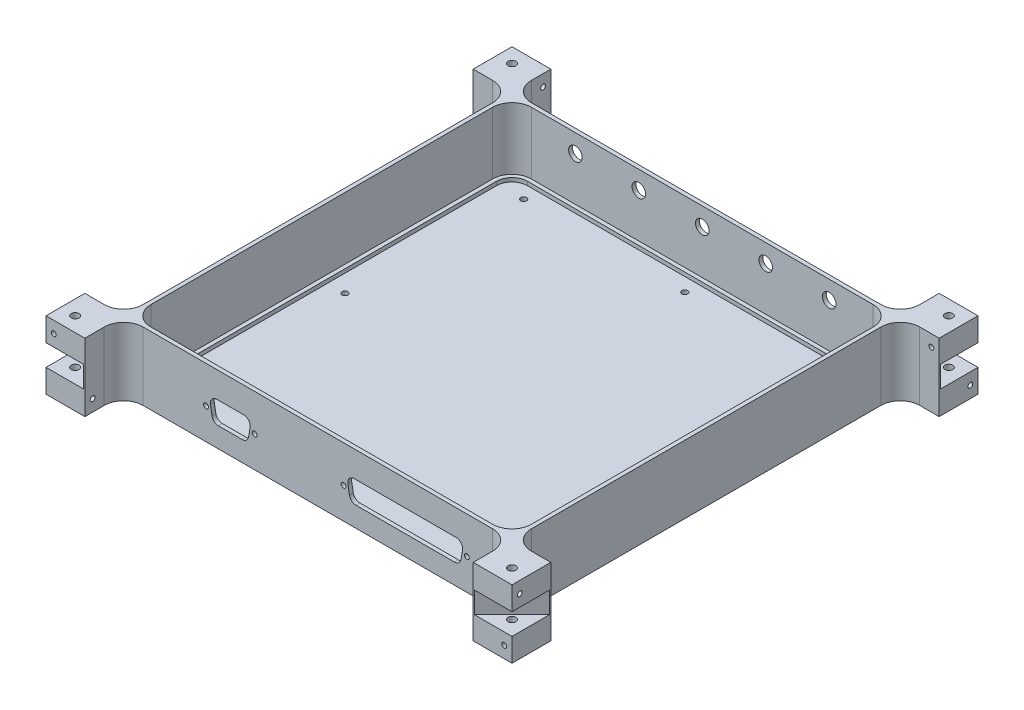
from build123d import *

# Parameters (mm, degrees)
BOSS_EXTRUDE1_DEPTH                   = 17.5
CUT_EXTRUDE1_DEPTH                    = 32
CUT_EXTRUDE2_DEPTH                    = 2
BOSS_EXTRUDE2_DEPTH                   = 2
CUT_EXTRUDE3_DEPTH                    = 11
CIRPATTERN1_COUNT                     = 4
SKETCH6_R                             = 2
CUT_EXTRUDE4_DEPTH                    = 174.692256592
CIRPATTERN2_COUNT                     = 4
TAP_DRILL_FOR_M3_TAP1_D               = 2.5
TAP_DRILL_FOR_M3_TAP1_DEPTH           = 20
TAP_DRILL_FOR_M3_TAP1_ON_FACE_2_D     = 2.5
TAP_DRILL_FOR_M3_TAP1_ON_FACE_2_DEPTH = 20
TAP_DRILL_FOR_M3_TAP1_ON_FACE_3_D     = 2.5
TAP_DRILL_FOR_M3_TAP1_ON_FACE_3_DEPTH = 20
TAP_DRILL_FOR_M3_TAP1_ON_FACE_4_D     = 2.5
TAP_DRILL_FOR_M3_TAP1_ON_FACE_4_DEPTH = 20
F_3_0_3_DIAMETER_HOLE1_D              = 3
F_3_0_3_DIAMETER_HOLE1_DEPTH          = 20
F_3_0_3_DIAMETER_HOLE1_TIP            = 0.901290929
CUT_EXTRUDE5_REACH                    = 253.357
SKETCH16_R                            = 3.5
CUT_EXTRUDE6_DEPTH                    = 10
M3X0_5_TAPPED_HOLE1_D                 = 2.5
M3X0_5_TAPPED_HOLE1_DEPTH             = 5
M3X0_5_TAPPED_HOLE1_TIP               = 0.751075774


with BuildPart() as part:
    # Sketch1 → Boss-Extrude1 (new, symmetric)
    with BuildSketch(Plane(origin=(0, 0, 0), x_dir=(1, 0, 0), z_dir=(0, 1, 0))):
        with BuildLine():
            ThreePointArc((-110, 100), (-102.928932188, 97.071067812), (-100, 90))
            Line((-100, 90), (-100, -90))
            ThreePointArc((-100, -90), (-102.928932188, -97.071067812), (-110, -100))
            Line((-110, -100), (-120, -100))
            Line((-120, -100), (-120, -120))
            Line((-120, -120), (-100, -120))
            Line((-100, -120), (-100, -110))
            ThreePointArc((-100, -110), (-97.071067812, -102.928932188), (-90, -100))
            Line((-90, -100), (90, -100))
            ThreePointArc((90, -100), (97.071067812, -102.928932188), (100, -110))
            Line((100, -110), (100, -120))
            Line((100, -120), (120, -120))
            Line((120, -120), (120, -100))
            Line((120, -100), (110, -100))
            ThreePointArc((110, -100), (102.928932188, -97.071067812), (100, -90))
            Line((100, -90), (100, 90))
            ThreePointArc((100, 90), (102.928932188, 97.071067812), (110, 100))
            Line((110, 100), (120, 100))
            Line((120, 100), (120, 120))
            Line((120, 120), (100, 120))
            Line((100, 120), (100, 110))
            ThreePointArc((100, 110), (97.071067812, 102.928932188), (90, 100))
            Line((90, 100), (-90, 100))
            ThreePointArc((-90, 100), (-97.071067812, 102.928932188), (-100, 110))
            Line((-100, 110), (-100, 120))
            Line((-100, 120), (-120, 120))
            Line((-120, 120), (-120, 100))
            Line((-120, 100), (-110, 100))
        make_face()
    extrude(amount=BOSS_EXTRUDE1_DEPTH, both=True)

    # Sketch2 → Cut-Extrude1 (cut)
    with BuildSketch(Plane(origin=(0, 17.5, 0), x_dir=(1, 0, 0), z_dir=(0, 1, 0))):
        with BuildLine():
            Line((-88, 98), (88, 98))
            ThreePointArc((88, 98), (95.071067812, 95.071067812), (98, 88))
            Line((98, 88), (98, -88))
            ThreePointArc((98, -88), (95.071067812, -95.071067812), (88, -98))
            Line((88, -98), (-88, -98))
            ThreePointArc((-88, -98), (-95.071067812, -95.071067812), (-98, -88))
            Line((-98, -88), (-98, 88))
            ThreePointArc((-98, 88), (-95.071067812, 95.071067812), (-88, 98))
        make_face()
    extrude(amount=-CUT_EXTRUDE1_DEPTH, mode=Mode.SUBTRACT)

    # Sketch3 → Cut-Extrude2 (cut)
    with BuildSketch(Plane(origin=(0, -14.5, 0), x_dir=(1, 0, 0), z_dir=(0, 1, 0))):
        with BuildLine():
            Line((-88, -96), (88, -96))
            ThreePointArc((88, -96), (93.656854249, -93.656854249), (96, -88))
            Line((96, -88), (96, 88))
            ThreePointArc((96, 88), (93.656854249, 93.656854249), (88, 96))
            Line((88, 96), (-88, 96))
            ThreePointArc((-88, 96), (-93.656854249, 93.656854249), (-96, 88))
            Line((-96, 88), (-96, -88))
            ThreePointArc((-96, -88), (-93.656854249, -93.656854249), (-88, -96))
        make_face()
    extrude(amount=-CUT_EXTRUDE2_DEPTH, mode=Mode.SUBTRACT)

    # Sketch4 → Boss-Extrude2 (add)
    with BuildSketch(Plane.XZ.offset(17.5)):
        with BuildLine():
            Line((-88, -98), (88, -98))
            ThreePointArc((88, -98), (95.071067812, -95.071067812), (98, -88))
            Line((98, -88), (98, 88))
            ThreePointArc((98, 88), (95.071067812, 95.071067812), (88, 98))
            Line((88, 98), (-88, 98))
            ThreePointArc((-88, 98), (-95.071067812, 95.071067812), (-98, 88))
            Line((-98, 88), (-98, -88))
            ThreePointArc((-98, -88), (-95.071067812, -95.071067812), (-88, -98))
        make_face()
    extrude(amount=BOSS_EXTRUDE2_DEPTH)

    # Sketch5 → Cut-Extrude3 (cut)
    with BuildSketch(Plane(origin=(0, -5.5, 0), x_dir=(1, 0, 0), z_dir=(0, 1, 0))):
        Polygon((-120, 100.61731573), (-100.61731573, 120), (-120, 120), align=None)
    cut_extrude3 = extrude(amount=CUT_EXTRUDE3_DEPTH, mode=Mode.SUBTRACT)

    # CirPattern1: Cut-Extrude3 ×4 about axis
    cirpattern1_axis = Axis((0, 0, 0), (0, 1, 0))
    for i in range(1, CIRPATTERN1_COUNT):
        add(cut_extrude3.rotate(cirpattern1_axis, i * 360 / CIRPATTERN1_COUNT), mode=Mode.SUBTRACT)

    # Sketch6 → Cut-Extrude4 (cut, through all)
    with BuildSketch(Plane(origin=(0, 17.5, 0), x_dir=(1, 0, 0), z_dir=(0, 1, 0))):
        with Locations(Location((-112.493820949, 112.493820949, 0), (0, 0, 270))):
            Circle(SKETCH6_R)
    cut_extrude4 = extrude(amount=-CUT_EXTRUDE4_DEPTH, mode=Mode.SUBTRACT)

    # CirPattern2: Cut-Extrude4 ×4 about axis
    cirpattern2_axis = Axis((0, 0, 0), (0, 1, 0))
    for i in range(1, CIRPATTERN2_COUNT):
        add(cut_extrude4.rotate(cirpattern2_axis, i * 360 / CIRPATTERN2_COUNT), mode=Mode.SUBTRACT)

    # Tap Drill for M3 Tap1
    with Locations(Plane(origin=(116, 11.5, -120), x_dir=(-1, 0, 0), z_dir=(0, 0, -1))):
        with Locations((0, 0), (232, -23)):
            Hole(TAP_DRILL_FOR_M3_TAP1_D / 2, depth=TAP_DRILL_FOR_M3_TAP1_DEPTH)

    # Tap Drill for M3 Tap1 on face 2
    with Locations(Plane(origin=(-120, 11.5, -116), x_dir=(0, 0, -1), z_dir=(-1, 0, 0))):
        with Locations((0, 0), (-232, 23)):
            Hole(TAP_DRILL_FOR_M3_TAP1_ON_FACE_2_D / 2, depth=TAP_DRILL_FOR_M3_TAP1_ON_FACE_2_DEPTH)

    # Tap Drill for M3 Tap1 on face 3
    with Locations(Plane(origin=(-116, 11.5, 120), x_dir=(1, 0, 0), z_dir=(0, 0, 1))):
        with Locations((0, 0), (232, -23)):
            Hole(TAP_DRILL_FOR_M3_TAP1_ON_FACE_3_D / 2, depth=TAP_DRILL_FOR_M3_TAP1_ON_FACE_3_DEPTH)

    # Tap Drill for M3 Tap1 on face 4
    with Locations(Plane(origin=(120, 11.5, 116), x_dir=(0, 0, 1), z_dir=(1, 0, 0))):
        with Locations((0, 0), (-232, 23)):
            Hole(TAP_DRILL_FOR_M3_TAP1_ON_FACE_4_D / 2, depth=TAP_DRILL_FOR_M3_TAP1_ON_FACE_4_DEPTH)

    # Ø3.0 (3) Diameter Hole1
    with Locations(Plane(origin=(0, 0, 0), x_dir=(1, 0, 0), z_dir=(0, 1, 0))):
        with Locations((-83, 89), (0, 89), (83, 89), (87, 1), (-87, 1), (-87, -87), (0, -87), (87, -87)):
            Hole(F_3_0_3_DIAMETER_HOLE1_D / 2, depth=F_3_0_3_DIAMETER_HOLE1_DEPTH)
            with Locations((0, 0, -(F_3_0_3_DIAMETER_HOLE1_DEPTH + F_3_0_3_DIAMETER_HOLE1_TIP / 2))):  # 118° drill point
                Cone(0, F_3_0_3_DIAMETER_HOLE1_D / 2, F_3_0_3_DIAMETER_HOLE1_TIP, mode=Mode.SUBTRACT)

    # Sketch16 → Cut-Extrude5 (cut, up to next)
    with BuildSketch(Plane(origin=(0, 0, -100), x_dir=(-1, 0, 0), z_dir=(0, 0, -1)), mode=Mode.PRIVATE) as cut_extrude5_sk1:
        with Locations((0, 8.1)):
            Circle(SKETCH16_R)
    cut_extrude5_tool1 = extrude(cut_extrude5_sk1.sketch, amount=-CUT_EXTRUDE5_REACH, mode=Mode.PRIVATE) & part.part
    # Sketch16 → Cut-Extrude5 (cut, up to next)
    with BuildSketch(Plane(origin=(0, 0, -100), x_dir=(-1, 0, 0), z_dir=(0, 0, -1)), mode=Mode.PRIVATE) as cut_extrude5_sk2:
        with Locations((32.67, 8.1)):
            Circle(SKETCH16_R)
    cut_extrude5_tool2 = extrude(cut_extrude5_sk2.sketch, amount=-CUT_EXTRUDE5_REACH, mode=Mode.PRIVATE) & part.part
    # Sketch16 → Cut-Extrude5 (cut, up to next)
    with BuildSketch(Plane(origin=(0, 0, -100), x_dir=(-1, 0, 0), z_dir=(0, 0, -1)), mode=Mode.PRIVATE) as cut_extrude5_sk3:
        with Locations((65.34, 8.1)):
            Circle(SKETCH16_R)
    cut_extrude5_tool3 = extrude(cut_extrude5_sk3.sketch, amount=-CUT_EXTRUDE5_REACH, mode=Mode.PRIVATE) & part.part
    # Sketch16 → Cut-Extrude5 (cut, up to next)
    with BuildSketch(Plane(origin=(0, 0, -100), x_dir=(-1, 0, 0), z_dir=(0, 0, -1)), mode=Mode.PRIVATE) as cut_extrude5_sk4:
        with Locations((-32.67, 8.1)):
            Circle(SKETCH16_R)
    cut_extrude5_tool4 = extrude(cut_extrude5_sk4.sketch, amount=-CUT_EXTRUDE5_REACH, mode=Mode.PRIVATE) & part.part
    # Sketch16 → Cut-Extrude5 (cut, up to next)
    with BuildSketch(Plane(origin=(0, 0, -100), x_dir=(-1, 0, 0), z_dir=(0, 0, -1)), mode=Mode.PRIVATE) as cut_extrude5_sk5:
        with Locations((-65.34, 8.1)):
            Circle(SKETCH16_R)
    cut_extrude5_tool5 = extrude(cut_extrude5_sk5.sketch, amount=-CUT_EXTRUDE5_REACH, mode=Mode.PRIVATE) & part.part
    add(cut_extrude5_tool1.solids().sort_by_distance((0, 8.1, -100))[0], mode=Mode.SUBTRACT)
    add(cut_extrude5_tool2.solids().sort_by_distance((-32.67, 8.1, -100))[0], mode=Mode.SUBTRACT)
    add(cut_extrude5_tool3.solids().sort_by_distance((-65.34, 8.1, -100))[0], mode=Mode.SUBTRACT)
    add(cut_extrude5_tool4.solids().sort_by_distance((32.67, 8.1, -100))[0], mode=Mode.SUBTRACT)
    add(cut_extrude5_tool5.solids().sort_by_distance((65.34, 8.1, -100))[0], mode=Mode.SUBTRACT)

    # Sketch17 → Cut-Extrude6 (cut)
    with BuildSketch(Plane.XY.offset(100)):
        with BuildLine():
            Line((-51.97665364, 4.23), (-38.20334636, 4.23))
            ThreePointArc((-38.20334636, 4.23), (-35.598795254, 3.015477873), (-34.855, 0.239596196))
            Line((-34.855, 0.239596196), (-35.666104111, -4.360403804))
            ThreePointArc((-35.666104111, -4.360403804), (-36.828972599, -6.374551107), (-39.014450472, -7.17))
            Line((-39.014450472, -7.17), (-51.165549528, -7.17))
            ThreePointArc((-51.165549528, -7.17), (-53.351027401, -6.374551107), (-54.513895889, -4.360403804))
            Line((-54.513895889, -4.360403804), (-55.325, 0.239596196))
            ThreePointArc((-55.325, 0.239596196), (-54.581204746, 3.015477873), (-51.97665364, 4.23))
        make_face()
        with BuildLine():
            Line((16.271104111, -4.360403804), (15.46, 0.239596196))
            ThreePointArc((15.46, 0.239596196), (16.203795254, 3.015477873), (18.80834636, 4.23))
            Line((18.80834636, 4.23), (71.19165364, 4.23))
            ThreePointArc((71.19165364, 4.23), (73.796204746, 3.015477873), (74.54, 0.239596196))
            Line((74.54, 0.239596196), (73.728895889, -4.360403804))
            ThreePointArc((73.728895889, -4.360403804), (72.566027401, -6.374551107), (70.380549528, -7.17))
            Line((70.380549528, -7.17), (19.619450472, -7.17))
            ThreePointArc((19.619450472, -7.17), (17.433972599, -6.374551107), (16.271104111, -4.360403804))
        make_face()
    extrude(amount=-CUT_EXTRUDE6_DEPTH, mode=Mode.SUBTRACT)

    # M3x0.5 Tapped Hole1
    with Locations(Plane.XY.offset(100)):
        with Locations((-57.585, -1.47), (-32.595, -1.47), (13.25, -1.47), (76.75, -1.47)):
            Hole(M3X0_5_TAPPED_HOLE1_D / 2, depth=M3X0_5_TAPPED_HOLE1_DEPTH)
            with Locations((0, 0, -(M3X0_5_TAPPED_HOLE1_DEPTH + M3X0_5_TAPPED_HOLE1_TIP / 2))):  # 118° drill point
                Cone(0, M3X0_5_TAPPED_HOLE1_D / 2, M3X0_5_TAPPED_HOLE1_TIP, mode=Mode.SUBTRACT)


solid = part.part
